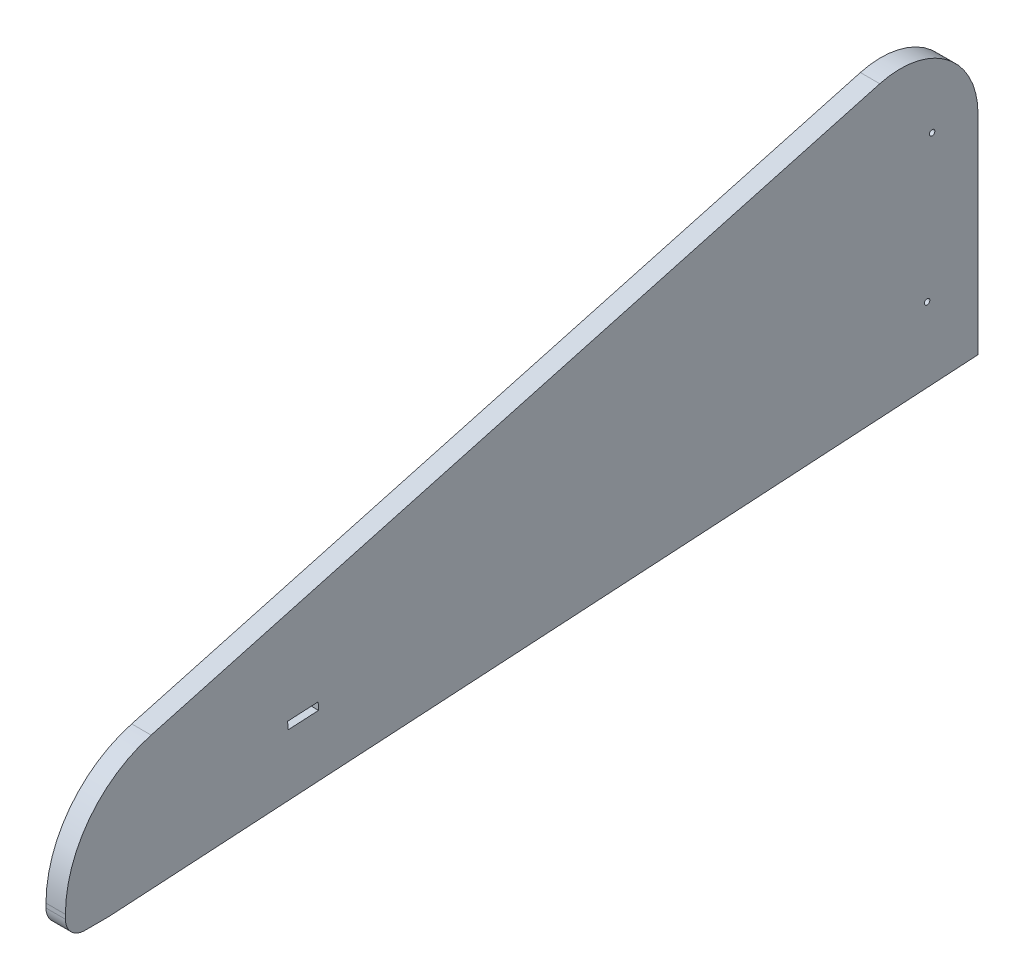
from build123d import *

# Parameters (mm, degrees)
BOSS_EXTRUDE1_DEPTH = 12.7
FILLET1_R           = 76.2
FILLET2_R           = 50.8
FILLET3_R           = 12.7
SKETCH1_3_R         = 1.778
CUT_EXTRUDE1_DEPTH  = 32.004
SKETCH1_5_R         = 1.778
CUT_EXTRUDE3_DEPTH  = 19.304
SKETCH2_W           = 20
SKETCH2_H           = 5
CUT_EXTRUDE4_DEPTH  = 5
CUT_EXTRUDE5_DEPTH  = 5


with BuildPart() as part:
    # Sketch1 → Boss-Extrude1 (new body)
    with BuildSketch(Plane(origin=(0, 0, 0), x_dir=(0, 0, -1), z_dir=(1, 0, 0))):
        Polygon((-60.216908745, 47.566393508), (-60.216908745, -26.034482759), (-31.989836752, -26.034482759), (536.590579473, 7.973019947), (536.590579473, 211.173019947), align=None)
    extrude(amount=BOSS_EXTRUDE1_DEPTH)

    # Fillet1
    fillet1_edges = [part.edges().sort_by_distance(p)[0] for p in [
        (6.35, 47.566393508, 60.216908745),
    ]]
    fillet(fillet1_edges, radius=FILLET1_R)

    # Fillet2
    fillet2_edges = [part.edges().sort_by_distance(p)[0] for p in [
        (6.35, 211.173019947, -536.590579473),
    ]]
    fillet(fillet2_edges, radius=FILLET2_R)

    # Fillet3
    fillet3_edges = [part.edges().sort_by_distance(p)[0] for p in [
        (6.35, -26.034482759, 60.216908745),
    ]]
    fillet(fillet3_edges, radius=FILLET3_R)

    # Sketch1<3> → Cut-Extrude1 (cut)
    with BuildSketch(Plane(origin=(0, 0, 0), x_dir=(0, 0, -1), z_dir=(1, 0, 0))):
        with Locations((503.316579473, 54.583559733)):
            Circle(SKETCH1_3_R)
    extrude(amount=CUT_EXTRUDE1_DEPTH, mode=Mode.SUBTRACT)

    # Sketch1<5> → Cut-Extrude3 (cut)
    with BuildSketch(Plane(origin=(0, 0, 0), x_dir=(0, 0, -1), z_dir=(1, 0, 0))):
        with Locations((506.618579473, 148.702123969)):
            Circle(SKETCH1_5_R)
    extrude(amount=CUT_EXTRUDE3_DEPTH, mode=Mode.SUBTRACT)

    # Sketch2 → Cut-Extrude4 (cut)
    with BuildSketch(Plane(origin=(12.7, -3.610856195, -1.673147661), x_dir=(0, 0.05233595624294395, -0.9986295347545739), z_dir=(1, 0, 0))):
        with Locations((94.879123185, 22.820976731)):
            Rectangle(SKETCH2_W, SKETCH2_H)
    extrude(amount=-CUT_EXTRUDE4_DEPTH, mode=Mode.SUBTRACT)

    # Sketch3 → Cut-Extrude5 (cut)
    with BuildSketch(Plane.ZY):
        Polygon((-85.110749427, 26.117649094), (-85.372429208, 21.12450142), (-105.345019904, 22.171220545), (-105.083340122, 27.164368219), align=None)
    extrude(amount=-CUT_EXTRUDE5_DEPTH, mode=Mode.SUBTRACT)


solid = part.part
